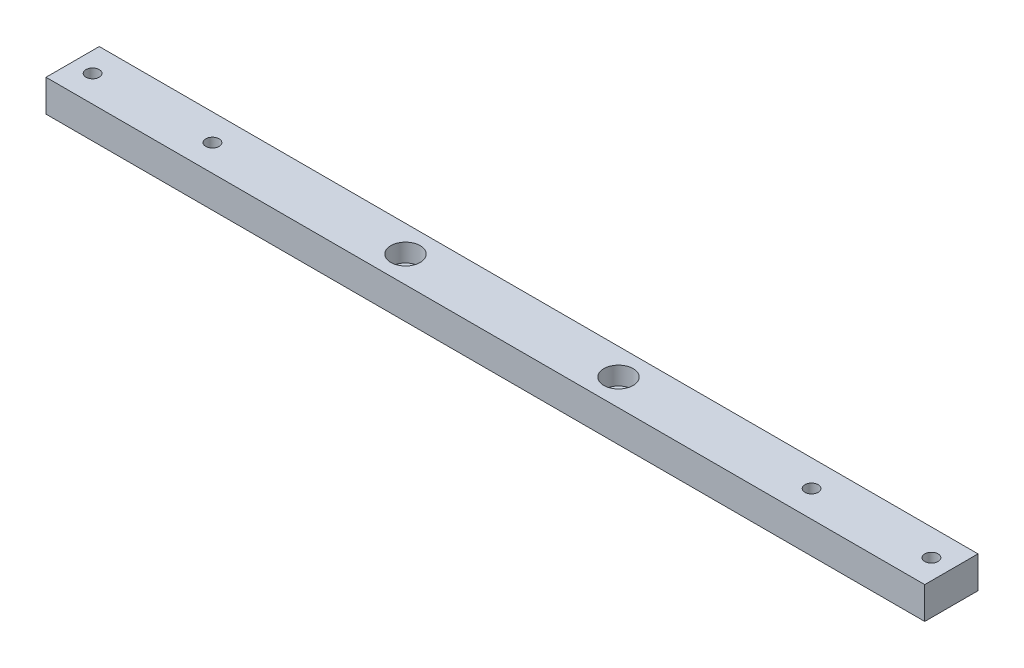
from build123d import *

# Parameters (mm, degrees)
SKETCH_1_W                = 330
SKETCH_1_H                = 20
EXTRUDE_1_DEPTH           = 12
HOLE_WIZARD_M6_1_D        = 5
HOLE_WIZARD_M6_1_DEPTH    = 15
HOLE_WIZARD_M6_1_TIP      = 1.502151548
HOLE_WIZARD_1_D           = 6.6
HOLE_WIZARD_1_CBORE_D     = 11
HOLE_WIZARD_1_CBORE_DEPTH = 6.8


with BuildPart() as part:
    # 草图1 → 凸台-拉伸1 (new body)
    with BuildSketch(Plane(origin=(0, 0, 0), x_dir=(1, 0, 0), z_dir=(0, 1, 0))):
        Rectangle(SKETCH_1_W, SKETCH_1_H)
    extrude(amount=EXTRUDE_1_DEPTH)

    # M6 螺纹孔1
    with Locations(Plane(origin=(0, 12, 0), x_dir=(1, 0, 0), z_dir=(0, 1, 0))):
        with Locations((-157.5, 0), (-112.5, 0), (112.5, 0), (157.5, 0)):
            Hole(HOLE_WIZARD_M6_1_D / 2, depth=HOLE_WIZARD_M6_1_DEPTH)
            with Locations((0, 0, -(HOLE_WIZARD_M6_1_DEPTH + HOLE_WIZARD_M6_1_TIP / 2))):  # 118° drill point
                Cone(0, HOLE_WIZARD_M6_1_D / 2, HOLE_WIZARD_M6_1_TIP, mode=Mode.SUBTRACT)

    # 打孔尺寸根据内六角圆柱头螺钉的类型1 (through all)
    with Locations(Plane(origin=(0, 12, 0), x_dir=(1, 0, 0), z_dir=(0, 1, 0))):
        with Locations((-40, 0), (40, 0)):
            CounterBoreHole(HOLE_WIZARD_1_D / 2, HOLE_WIZARD_1_CBORE_D / 2, HOLE_WIZARD_1_CBORE_DEPTH)


solid = part.part
